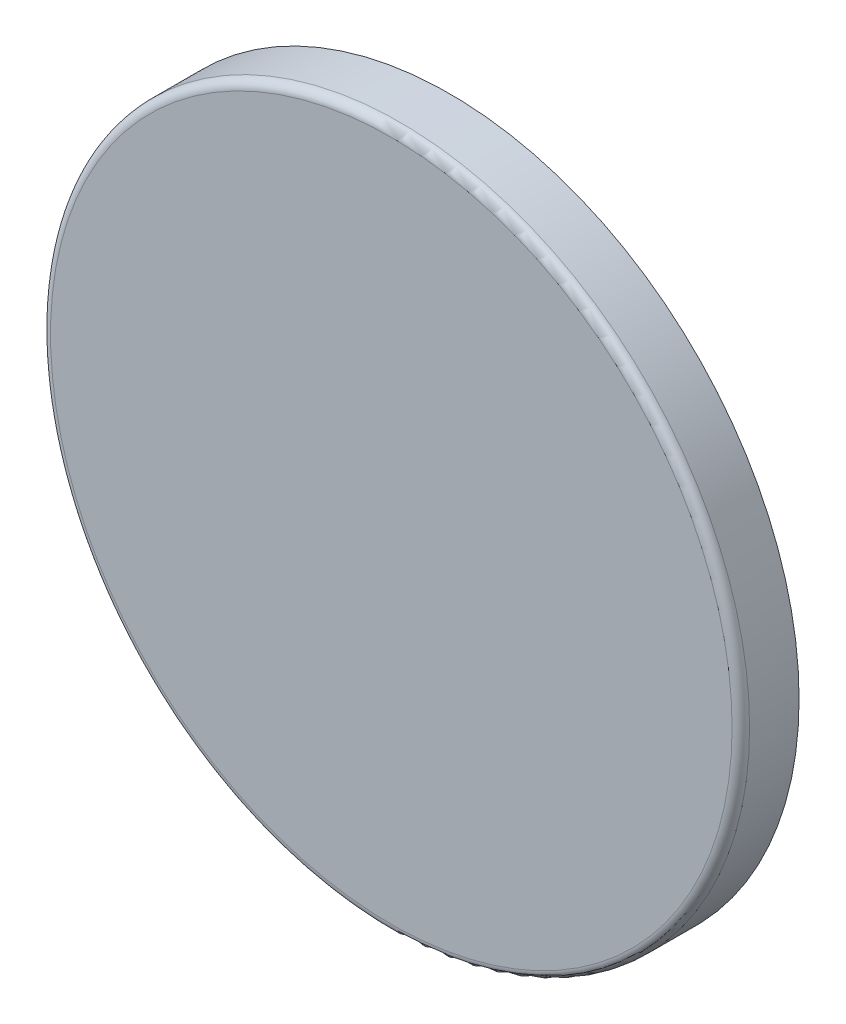
from build123d import *

# Parameters (mm, degrees)
SKETCH_1_R      = 6
EXTRUDE_1_DEPTH = 1
FILLET_1_R      = 0.15


with BuildPart() as part:
    # 草图1 → 凸台-拉伸1 (new body)
    with BuildSketch(Plane.XY):
        Circle(SKETCH_1_R)
    extrude(amount=EXTRUDE_1_DEPTH)

    # 圆角1
    fillet_1_edges = [part.edges().sort_by_distance(p)[0] for p in [
        (-6, 0, 1),
    ]]
    fillet(fillet_1_edges, radius=FILLET_1_R)


solid = part.part
